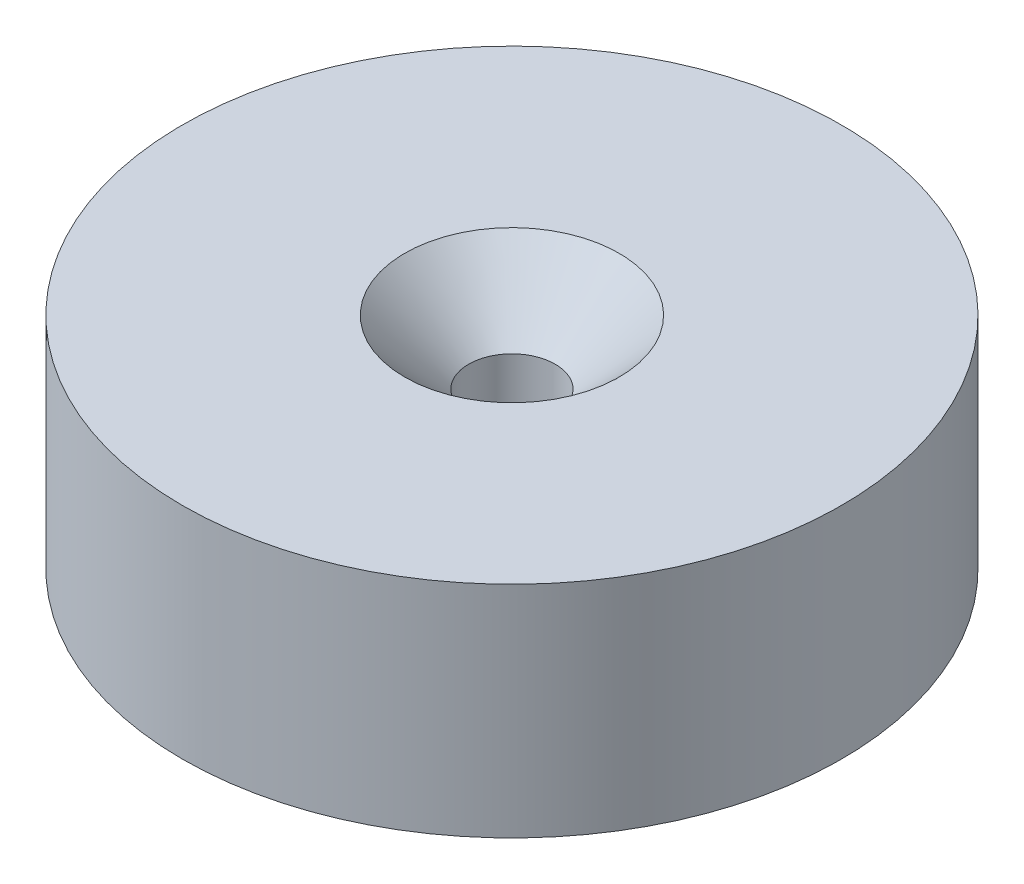
from build123d import *

# Parameters (mm, degrees)
SKETCH1_R                       = 19.05
BOSS_EXTRUDE1_DEPTH             = 12.7
M6X1_0_TAPPED_HOLE1_D           = 5
M6X1_0_TAPPED_HOLE1_CSINK_D     = 12.4
M6X1_0_TAPPED_HOLE1_CSINK_ANGLE = 90


with BuildPart() as part:
    # Sketch1 → Boss-Extrude1 (new body)
    with BuildSketch(Plane(origin=(0, 0, 0), x_dir=(1, 0, 0), z_dir=(0, 1, 0))):
        with Locations(Location((0, 0, 0), (0, 0, 270))):
            Circle(SKETCH1_R)
    extrude(amount=BOSS_EXTRUDE1_DEPTH)

    # M6x1.0 Tapped Hole1 (through all)
    with Locations(Plane(origin=(0, 12.7, 0), x_dir=(1, 0, 0), z_dir=(0, 1, 0))):
        with Locations((0, 0)):
            CounterSinkHole(M6X1_0_TAPPED_HOLE1_D / 2, M6X1_0_TAPPED_HOLE1_CSINK_D / 2, counter_sink_angle=M6X1_0_TAPPED_HOLE1_CSINK_ANGLE)


solid = part.part
